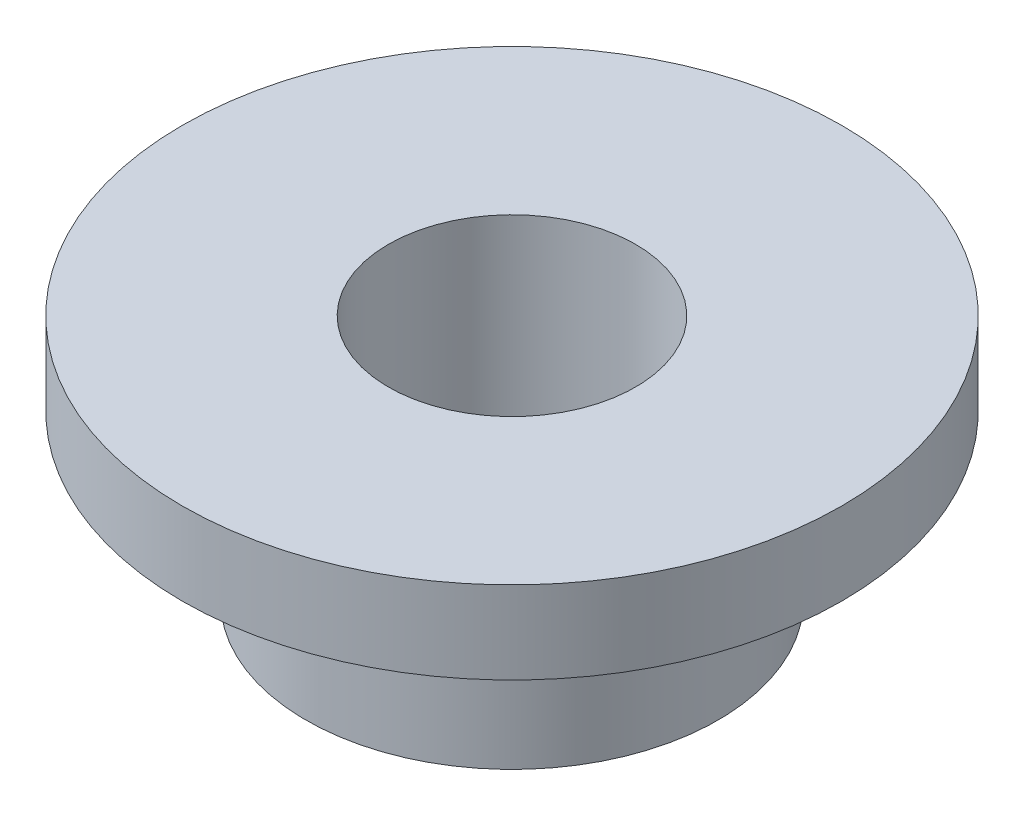
from build123d import *

# Parameters (mm, degrees)
SKETCH1_W = 1
SKETCH1_H = 2


with BuildPart() as part:
    # Sketch1 → Revolve1 (revolve)
    with BuildSketch(Plane.XY):
        Polygon((-4, 2), (-2.5, 2), (-1.5, 2), (-1.5, 3), (-4, 3), align=None)
        with Locations((-2, 1)):
            Rectangle(SKETCH1_W, SKETCH1_H)
    revolve(axis=Axis((0, 0, 0), (0, -1, 0)))


solid = part.part
